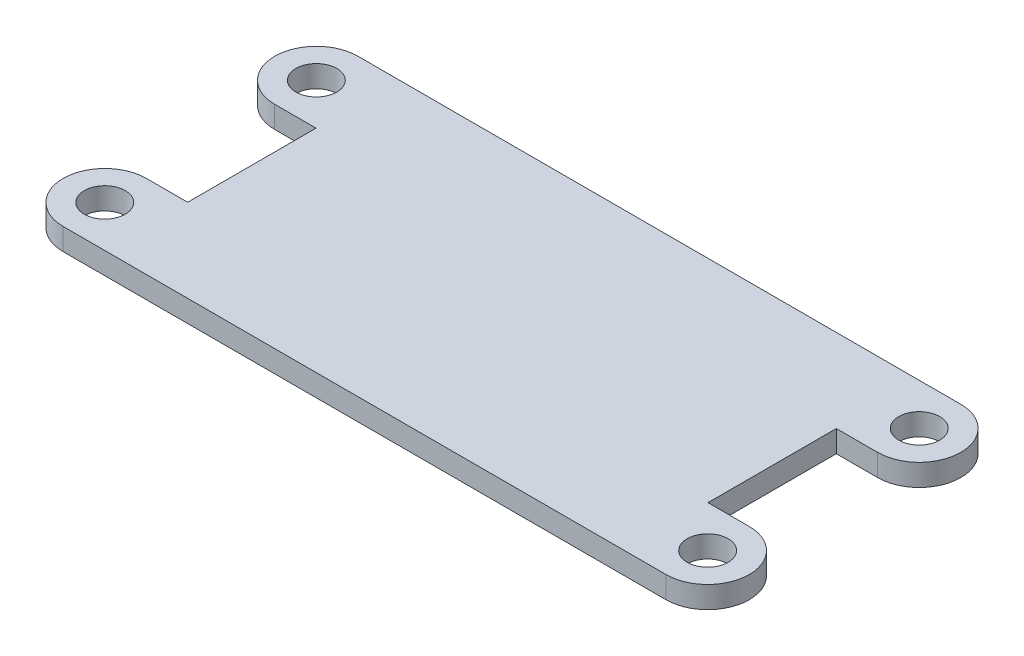
from build123d import *

# Parameters (mm, degrees)
SKETCH1_R           = 1.5
BOSS_EXTRUDE1_DEPTH = 0.8


with BuildPart() as part:
    # Sketch1 → Boss-Extrude1 (new, symmetric)
    # profile 1 of 9: a face of its own
    with BuildSketch(Plane(origin=(0, 0, 0), x_dir=(1, 0, 0), z_dir=(0, 1, 0))):
        with BuildLine():
            ThreePointArc((-19.05, -4.699), (-16.002, -7.747), (-19.05, -10.795))
            Line((-19.05, -10.795), (19.05, -10.795))
            ThreePointArc((19.05, -10.795), (16.002, -7.747), (19.05, -4.699))
            Line((19.05, -4.699), (19.05, 4.699))
            ThreePointArc((19.05, 4.699), (16.002, 7.747), (19.05, 10.795))
            Line((19.05, 10.795), (-19.05, 10.795))
            ThreePointArc((-19.05, 10.795), (-16.002, 7.747), (-19.05, 4.699))
            Line((-19.05, 4.699), (-19.05, -4.699))
        make_face()
    # profile 2 of 9: a face of its own
    with BuildSketch(Plane(origin=(0, 0, 0), x_dir=(1, 0, 0), z_dir=(0, 1, 0))):
        with BuildLine():
            Line((-22.075, -10.795), (-19.05, -10.795))
            Line((-19.05, -10.795), (-19.05, -4.699))
            Line((-19.05, -4.699), (-22.075, -4.699))
            ThreePointArc((-22.075, -4.699), (-25.123, -7.747), (-22.075, -10.795))
        make_face()
        with Locations(Location((-22.075, -7.747, 0), (0, 0, 270))):
            Circle(SKETCH1_R, mode=Mode.SUBTRACT)
    # profile 3 of 9: a face of its own
    with BuildSketch(Plane(origin=(0, 0, 0), x_dir=(1, 0, 0), z_dir=(0, 1, 0))):
        with BuildLine():
            Line((-19.05, -4.699), (-19.05, -10.795))
            ThreePointArc((-19.05, -10.795), (-16.002, -7.747), (-19.05, -4.699))
        make_face()
    # profile 4 of 9: a face of its own
    with BuildSketch(Plane(origin=(0, 0, 0), x_dir=(1, 0, 0), z_dir=(0, 1, 0))):
        with BuildLine():
            Line((-19.05, 10.795), (-19.05, 4.699))
            ThreePointArc((-19.05, 4.699), (-16.002, 7.747), (-19.05, 10.795))
        make_face()
    # profile 5 of 9: a face of its own
    with BuildSketch(Plane(origin=(0, 0, 0), x_dir=(1, 0, 0), z_dir=(0, 1, 0))):
        with BuildLine():
            Line((-22.075, 4.699), (-19.05, 4.699))
            Line((-19.05, 4.699), (-19.05, 10.795))
            Line((-19.05, 10.795), (-22.075, 10.795))
            ThreePointArc((-22.075, 10.795), (-25.123, 7.747), (-22.075, 4.699))
        make_face()
        with Locations(Location((-22.075, 7.747, 0), (0, 0, 270))):
            Circle(SKETCH1_R, mode=Mode.SUBTRACT)
    # profile 6 of 9: a face of its own
    with BuildSketch(Plane(origin=(0, 0, 0), x_dir=(1, 0, 0), z_dir=(0, 1, 0))):
        with BuildLine():
            ThreePointArc((19.05, 10.795), (16.002, 7.747), (19.05, 4.699))
            Line((19.05, 4.699), (19.05, 10.795))
        make_face()
    # profile 7 of 9: a face of its own
    with BuildSketch(Plane(origin=(0, 0, 0), x_dir=(1, 0, 0), z_dir=(0, 1, 0))):
        with BuildLine():
            Line((19.05, 10.795), (19.05, 4.699))
            Line((19.05, 4.699), (22.075, 4.699))
            ThreePointArc((22.075, 4.699), (25.123, 7.747), (22.075, 10.795))
            Line((22.075, 10.795), (19.05, 10.795))
        make_face()
        with Locations(Location((22.075, 7.747, 0), (0, 0, 270))):
            Circle(SKETCH1_R, mode=Mode.SUBTRACT)
    # profile 8 of 9: a face of its own
    with BuildSketch(Plane(origin=(0, 0, 0), x_dir=(1, 0, 0), z_dir=(0, 1, 0))):
        with BuildLine():
            Line((19.05, -4.699), (19.05, -10.795))
            Line((19.05, -10.795), (22.075, -10.795))
            ThreePointArc((22.075, -10.795), (25.123, -7.747), (22.075, -4.699))
            Line((22.075, -4.699), (19.05, -4.699))
        make_face()
        with Locations(Location((22.075, -7.747, 0), (0, 0, 270))):
            Circle(SKETCH1_R, mode=Mode.SUBTRACT)
    # profile 9 of 9: a face of its own
    with BuildSketch(Plane(origin=(0, 0, 0), x_dir=(1, 0, 0), z_dir=(0, 1, 0))):
        with BuildLine():
            ThreePointArc((19.05, -4.699), (16.002, -7.747), (19.05, -10.795))
            Line((19.05, -10.795), (19.05, -4.699))
        make_face()
    extrude(amount=BOSS_EXTRUDE1_DEPTH, both=True)


solid = part.part
